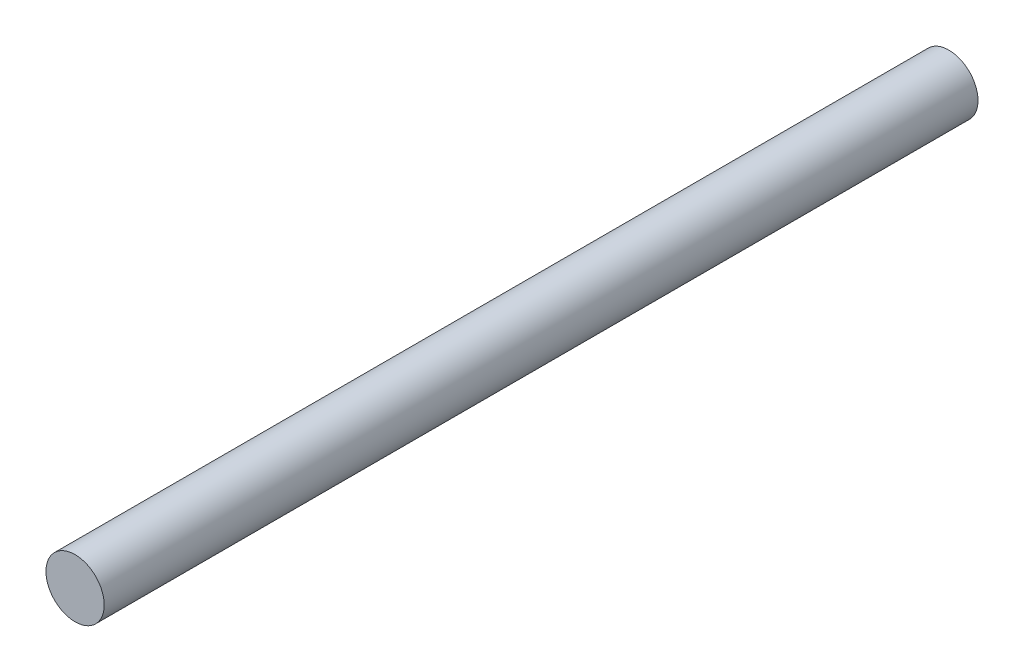
from build123d import *

# Parameters (mm, degrees)
SKETCH1_R           = 0.5
BOSS_EXTRUDE1_DEPTH = 15


with BuildPart() as part:
    # Sketch1 → Boss-Extrude1 (new body)
    with BuildSketch(Plane.XY):
        Circle(SKETCH1_R)
    extrude(amount=BOSS_EXTRUDE1_DEPTH)


solid = part.part
